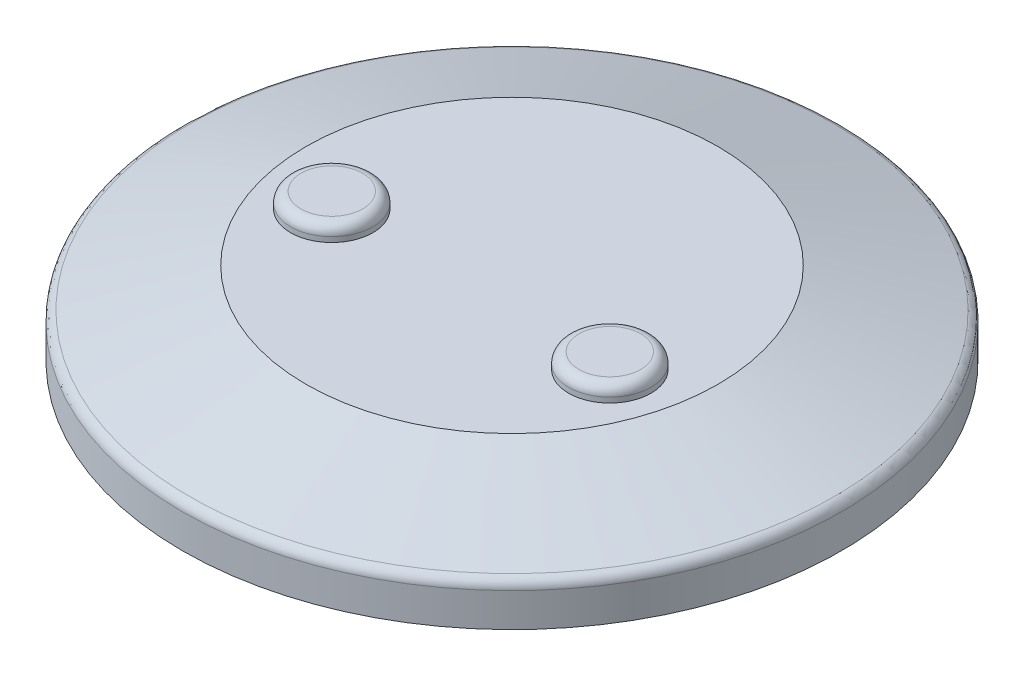
from build123d import *

# Parameters (mm, degrees)
SKETCH1_R           = 32
BOSS_EXTRUDE1_DEPTH = 4
SKETCH3_R           = 20
SKETCH2_R           = 32
FILLET1_R           = 1
SKETCH4_R           = 4
BOSS_EXTRUDE2_DEPTH = 1.5
FILLET2_R           = 1


with BuildPart() as part:
    # Sketch1 → Boss-Extrude1 (new body)
    with BuildSketch(Plane(origin=(0, 0, 0), x_dir=(1, 0, 0), z_dir=(0, 1, 0))):
        Circle(SKETCH1_R)
    extrude(amount=BOSS_EXTRUDE1_DEPTH)

    # Sketch3 → Loft1 section 0
    with BuildSketch(Plane(origin=(0, 8, 0), x_dir=(-1, 0, 0), z_dir=(0, 1, 0))):
        Circle(SKETCH3_R)
    # Sketch2 → Loft1 section 1
    with BuildSketch(Plane(origin=(0, 4, 0), x_dir=(1, 0, 0), z_dir=(0, 1, 0))):
        Circle(SKETCH2_R)
    loft()

    # Fillet1
    fillet1_edges = [part.edges().sort_by_distance(p)[0] for p in [
        (0, 4, 32),
    ]]
    fillet(fillet1_edges, radius=FILLET1_R)

    # Sketch4 → Boss-Extrude2 (add)
    with BuildSketch(Plane(origin=(0, 8, 0), x_dir=(1, 0, 0), z_dir=(0, 1, 0))):
        with Locations((-13.5, -4)):
            Circle(SKETCH4_R)
        with Locations((13.5, -4)):
            Circle(SKETCH4_R)
    extrude(amount=BOSS_EXTRUDE2_DEPTH)

    # Fillet2
    fillet2_edges = [part.edges().sort_by_distance(p)[0] for p in [
        (-17.5, 9.5, 4),
        (9.5, 9.5, 4),
    ]]
    fillet(fillet2_edges, radius=FILLET2_R)


solid = part.part
